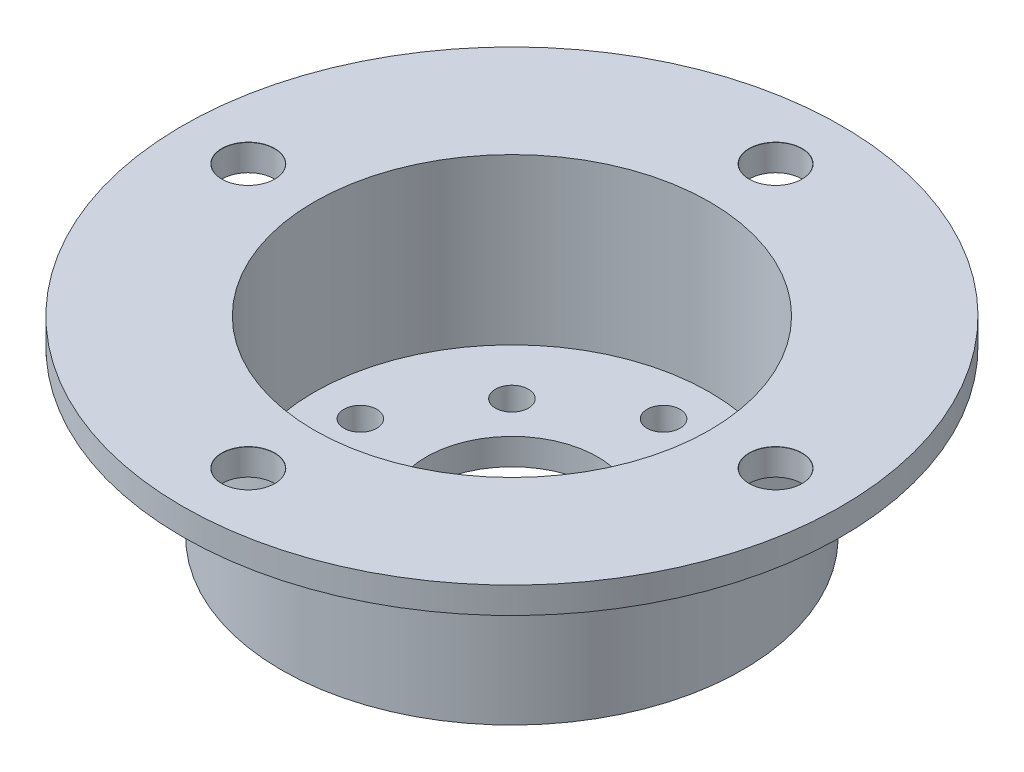
from build123d import *

# Parameters (mm, degrees)
SKETCH1_R                        = 35
SKETCH1_R_2                      = 13
BOSS_EXTRUDE1_DEPTH              = 4
F_5_0_MM_DOWEL_HOLES1_AT_2_COUNT = 2
F_5_0_MM_DOWEL_HOLES1_AT_2_PITCH = 32.526911935
F_5_0_MM_DOWEL_HOLES2_AT_2_COUNT = 2
F_5_0_MM_DOWEL_HOLES2_AT_2_PITCH = 28.284271247
BOSS_EXTRUDE2_START              = 21
SKETCH6_R                        = 35
SKETCH6_R_2                      = 30
BOSS_EXTRUDE2_DEPTH              = 21
BOSS_EXTRUDE3_START              = 4
SKETCH7_R                        = 50
SKETCH7_R_2                      = 30
BOSS_EXTRUDE3_DEPTH              = 4
F_8_0_MM_DOWEL_HOLES1_AT_2_COUNT = 2
F_8_0_MM_DOWEL_HOLES1_AT_2_PITCH = 56.568542495


with BuildPart() as part:
    # Sketch1 → Boss-Extrude1 (new body)
    with BuildSketch(Plane(origin=(0, 0, 0), x_dir=(1, 0, 0), z_dir=(0, 1, 0))):
        with Locations(Location((0, 0, 0), (0, 0, 270))):
            Circle(SKETCH1_R)
        with Locations(Location((0, 0, 0), (0, 0, 270))):
            Circle(SKETCH1_R_2, mode=Mode.SUBTRACT)
    extrude(amount=-BOSS_EXTRUDE1_DEPTH)

    # Sketch3 → Ø5.0 mm Dowel Holes1 (revolve, cut)
    with BuildSketch(Plane(origin=(0, -4, 23), x_dir=(0, 0, -1), z_dir=(1, 0, 0))):
        Polygon((0, 0), (0, 21.502151548), (2.5, 20), (2.5, 0.025), (2.525, 0), align=None)
    f_5_0_mm_dowel_holes1 = revolve(axis=Axis((0, -10.35, 23), (0, 1, 0)), mode=Mode.SUBTRACT)

    # Ø5.0 mm Dowel Holes1 at 2: Ø5.0 mm Dowel Holes1 ×2
    with Locations(*[Vector(-0.7071067811865476, 0, -0.7071067811865476) * (i * F_5_0_MM_DOWEL_HOLES1_AT_2_PITCH) for i in range(1, F_5_0_MM_DOWEL_HOLES1_AT_2_COUNT)]):
        add(f_5_0_mm_dowel_holes1, mode=Mode.SUBTRACT)

    # Mirror1: Ø5.0 mm Dowel Holes1 across plane
    add(f_5_0_mm_dowel_holes1.mirror(Plane(origin=(0, 0, 0), x_dir=(0, 0, 1), z_dir=(1, 0, 0))), mode=Mode.SUBTRACT)

    # Mirror1 copy 1 sketch → Mirror1 copy 1 (revolve, cut)
    with BuildSketch(Plane(origin=(23, -4, 0), x_dir=(0, 0, -1), z_dir=(-1, 0, 0))):
        Polygon((0, 0), (0, -21.502151548), (2.5, -20), (2.5, -0.025), (2.525, 0), align=None)
    revolve(axis=Axis((23, -10.35, 0), (0, -1, 0)), mode=Mode.SUBTRACT)

    # Mirror1 at the second plane: Ø5.0 mm Dowel Holes1 across plane
    add(f_5_0_mm_dowel_holes1.mirror(Plane.XY), mode=Mode.SUBTRACT)

    # Mirror1 at the second plane copy 1 sketc → Mirror1 at the second plane copy 1 (revolve, cut)
    with BuildSketch(Plane(origin=(-23, -4, 0), x_dir=(0, 0, 1), z_dir=(1, 0, 0))):
        Polygon((0, 0), (0, -21.502151548), (2.5, -20), (2.5, -0.025), (2.525, 0), align=None)
    revolve(axis=Axis((-23, -10.35, 0), (0, -1, 0)), mode=Mode.SUBTRACT)

    # Sketch5 → Ø5.0 mm Dowel Holes2 (revolve, cut)
    with BuildSketch(Plane(origin=(-14.142135624, -4, 14.142135624), x_dir=(0, 0, -1), z_dir=(1, 0, 0))):
        Polygon((0, 0), (0, 21.502151548), (2.5, 20), (2.5, 0.025), (2.525, 0), align=None)
    f_5_0_mm_dowel_holes2 = revolve(axis=Axis((-14.142135624, -10.35, 14.142135624), (0, 1, 0)), mode=Mode.SUBTRACT)

    # Ø5.0 mm Dowel Holes2 at 2: Ø5.0 mm Dowel Holes2 ×2
    with Locations(*[(i * F_5_0_MM_DOWEL_HOLES2_AT_2_PITCH, 0, 0) for i in range(1, F_5_0_MM_DOWEL_HOLES2_AT_2_COUNT)]):
        add(f_5_0_mm_dowel_holes2, mode=Mode.SUBTRACT)

    # Mirror2: Ø5.0 mm Dowel Holes2 across plane
    add(f_5_0_mm_dowel_holes2.mirror(Plane.XY), mode=Mode.SUBTRACT)

    # Mirror2 copy 1 sketch → Mirror2 copy 1 (revolve, cut)
    with BuildSketch(Plane(origin=(14.142135624, -4, -14.142135624), x_dir=(0, 0, 1), z_dir=(1, 0, 0))):
        Polygon((0, 0), (0, -21.502151548), (2.5, -20), (2.5, -0.025), (2.525, 0), align=None)
    revolve(axis=Axis((14.142135624, -10.35, -14.142135624), (0, -1, 0)), mode=Mode.SUBTRACT)

    # Sketch6 → Boss-Extrude2 (add)
    with BuildSketch(Plane(origin=(0, 0, 0), x_dir=(1, 0, 0), z_dir=(0, 1, 0)).offset(BOSS_EXTRUDE2_START)):
        with Locations(Location((0, 0, 0), (0, 0, 270))):
            Circle(SKETCH6_R)
        with Locations(Location((0, 0, 0), (0, 0, 90))):
            Circle(SKETCH6_R_2, mode=Mode.SUBTRACT)
    extrude(amount=-BOSS_EXTRUDE2_DEPTH)

    # Sketch7 → Boss-Extrude3 (add)
    with BuildSketch(Plane(origin=(0, 21, 0), x_dir=(1, 0, 0), z_dir=(0, 1, 0)).offset(BOSS_EXTRUDE3_START)):
        with Locations(Location((0, 0, 0), (0, 0, 270))):
            Circle(SKETCH7_R)
        with Locations(Location((0, 0, 0), (0, 0, 90))):
            Circle(SKETCH7_R_2, mode=Mode.SUBTRACT)
    extrude(amount=-BOSS_EXTRUDE3_DEPTH)

    # Sketch9 → Ø8.0 mm Dowel Holes1 (revolve, cut)
    with BuildSketch(Plane(origin=(0, 25, -40), x_dir=(0, 0, 1), z_dir=(1, 0, 0))):
        Polygon((0, 0), (0, 22.403442476), (4, 20), (4, 0.025), (4.025, 0), align=None)
    f_8_0_mm_dowel_holes1 = revolve(axis=Axis((0, 31.35, -40), (0, -1, 0)), mode=Mode.SUBTRACT)

    # Ø8.0 mm Dowel Holes1 at 2: Ø8.0 mm Dowel Holes1 ×2
    with Locations(*[Vector(-0.7071067811865476, 0, 0.7071067811865476) * (i * F_8_0_MM_DOWEL_HOLES1_AT_2_PITCH) for i in range(1, F_8_0_MM_DOWEL_HOLES1_AT_2_COUNT)]):
        add(f_8_0_mm_dowel_holes1, mode=Mode.SUBTRACT)

    # Mirror3: Ø8.0 mm Dowel Holes1 across plane
    add(f_8_0_mm_dowel_holes1.mirror(Plane(origin=(0, 0, 0), x_dir=(0, 0, 1), z_dir=(1, 0, 0))), mode=Mode.SUBTRACT)

    # Mirror3 copy 1 sketch → Mirror3 copy 1 (revolve, cut)
    with BuildSketch(Plane(origin=(40, 25, 0), x_dir=(0, 0, 1), z_dir=(-1, 0, 0))):
        Polygon((0, 0), (0, -22.403442476), (4, -20), (4, -0.025), (4.025, 0), align=None)
    revolve(axis=Axis((40, 31.35, 0), (0, 1, 0)), mode=Mode.SUBTRACT)

    # Mirror3 at the second plane: Ø8.0 mm Dowel Holes1 across plane
    add(f_8_0_mm_dowel_holes1.mirror(Plane.XY), mode=Mode.SUBTRACT)

    # Mirror3 at the second plane copy 1 sketc → Mirror3 at the second plane copy 1 (revolve, cut)
    with BuildSketch(Plane(origin=(-40, 25, 0), x_dir=(0, 0, -1), z_dir=(1, 0, 0))):
        Polygon((0, 0), (0, -22.403442476), (4, -20), (4, -0.025), (4.025, 0), align=None)
    revolve(axis=Axis((-40, 31.35, 0), (0, 1, 0)), mode=Mode.SUBTRACT)


solid = part.part
